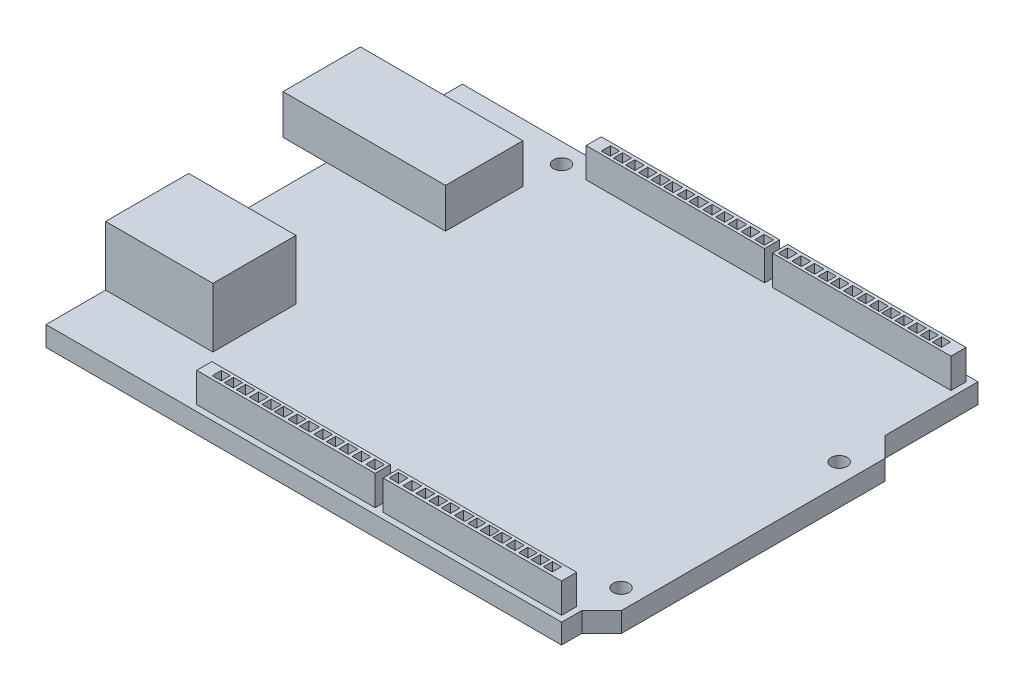
from build123d import *

# Parameters (mm, degrees)
SKETCH1_R           = 1.016
BOSS_EXTRUDE1_DEPTH = 2.54
SKETCH2_W           = 22.86
SKETCH2_H           = 1.936469456
SKETCH2_W_2         = 1.224555301
SKETCH2_H_2         = 1.184738843
SKETCH2_W_3         = 1.222138065
SKETCH2_W_4         = 1.222742374
SKETCH2_W_5         = 1.155879365
SKETCH2_W_6         = 1.199648959
SKETCH2_W_7         = 1.333979287
SKETCH2_W_8         = 1.107879608
SKETCH2_W_9         = 1.267720586
SKETCH2_W_10        = 1.269533513
SKETCH2_W_11        = 1.179577089
SKETCH2_W_12        = 1.200253268
SKETCH2_W_13        = 1.159505218
SKETCH2_W_14        = 1.15346213
SKETCH2_W_15        = 1.179577088
SKETCH2_W_16        = 1.269533512
SKETCH2_W_17        = 1.107879609
SKETCH2_W_18        = 1.153462129
BOSS_EXTRUDE2_DEPTH = 3.81
SKETCH3_W           = 15.229234195
SKETCH3_H           = 9.911935399
SKETCH3_W_2         = 5.581245223
BOSS_EXTRUDE3_DEPTH = 5.08
SKETCH4_W           = 13.73941142
SKETCH4_H           = 10.645162834
BOSS_EXTRUDE4_DEPTH = 7.62
SKETCH5_R           = 3.391596973
CUT_EXTRUDE1_DEPTH  = 7.62
SKETCH6_W           = 9.111468131
SKETCH6_H           = 4.354820338
CUT_EXTRUDE2_DEPTH  = 15.24
SKETCH7_W           = 8.100895968
SKETCH7_H           = 1.84111272
BOSS_EXTRUDE5_DEPTH = 13.97


with BuildPart() as part:
    # Sketch1 → Boss-Extrude1 (new body)
    with BuildSketch(Plane(origin=(0, 0, 0), x_dir=(1, 0, 0), z_dir=(0, 1, 0))):
        Polygon((0, 0), (66.04, 0), (66.04, 2.625008891), (68.58, 5.165008891), (68.58, 38.871058374), (66.04, 41.411058374), (66.04, 53.34), (0, 53.34), align=None)
        with Locations(Location((66.04, 7.62, 0), (0, 0, 270))):
            Circle(SKETCH1_R, mode=Mode.SUBTRACT)
        with Locations(Location((66.04, 35.56, 0), (0, 0, 270))):
            Circle(SKETCH1_R, mode=Mode.SUBTRACT)
        with Locations(Location((15.24, 50.8, 0), (0, 0, 270))):
            Circle(SKETCH1_R, mode=Mode.SUBTRACT)
    extrude(amount=BOSS_EXTRUDE1_DEPTH)

    # Sketch2 → Boss-Extrude2 (add)
    # profile 1 of 4: a face of its own
    with BuildSketch(Plane(origin=(0, 2.54, 0), x_dir=(1, 0, 0), z_dir=(0, 1, 0))):
        with Locations((53.845851386, 51.609765272)):
            Rectangle(SKETCH2_W, SKETCH2_H)
        with Locations((43.404283902, 51.588990463)):
            Rectangle(SKETCH2_W_2, SKETCH2_H_2, mode=Mode.SUBTRACT)
        with Locations((45.159038485, 51.588990463)):
            Rectangle(SKETCH2_W_3, SKETCH2_H_2, mode=Mode.SUBTRACT)
        with Locations((46.847232211, 51.588990463)):
            Rectangle(SKETCH2_W_4, SKETCH2_H_2, mode=Mode.SUBTRACT)
        with Locations((48.479807482, 51.588990463)):
            Rectangle(SKETCH2_W_5, SKETCH2_H_2, mode=Mode.SUBTRACT)
        with Locations((50.07774263, 51.588990463)):
            Rectangle(SKETCH2_W_6, SKETCH2_H_2, mode=Mode.SUBTRACT)
        with Locations((51.809101642, 51.588990463)):
            Rectangle(SKETCH2_W_7, SKETCH2_H_2, mode=Mode.SUBTRACT)
        with Locations((53.430130204, 51.588990463)):
            Rectangle(SKETCH2_W_8, SKETCH2_H_2, mode=Mode.SUBTRACT)
        with Locations((55.084892426, 51.588990463)):
            Rectangle(SKETCH2_W_9, SKETCH2_H_2, mode=Mode.SUBTRACT)
        with Locations((56.683734038, 51.588990463)):
            Rectangle(SKETCH2_W_10, SKETCH2_H_2, mode=Mode.SUBTRACT)
        with Locations((58.327251707, 51.588990463)):
            Rectangle(SKETCH2_W_11, SKETCH2_H_2, mode=Mode.SUBTRACT)
        with Locations((59.980503156, 51.588990463)):
            Rectangle(SKETCH2_W_12, SKETCH2_H_2, mode=Mode.SUBTRACT)
        with Locations((61.556251353, 51.588990463)):
            Rectangle(SKETCH2_W_13, SKETCH2_H_2, mode=Mode.SUBTRACT)
        with Locations((63.107999671, 51.588990463)):
            Rectangle(SKETCH2_W_14, SKETCH2_H_2, mode=Mode.SUBTRACT)
    # profile 2 of 4: a face of its own
    with BuildSketch(Plane(origin=(0, 2.54, 0), x_dir=(1, 0, 0), z_dir=(0, 1, 0))):
        with Locations((29.969851386, 51.609765272)):
            Rectangle(SKETCH2_W, SKETCH2_H)
        with Locations((40.411418869, 51.588990463)):
            Rectangle(SKETCH2_W_2, SKETCH2_H_2, mode=Mode.SUBTRACT)
        with Locations((22.25945142, 51.588990463)):
            Rectangle(SKETCH2_W_13, SKETCH2_H_2, mode=Mode.SUBTRACT)
        with Locations((23.835199616, 51.588990463)):
            Rectangle(SKETCH2_W_12, SKETCH2_H_2, mode=Mode.SUBTRACT)
        with Locations((25.488451066, 51.588990463)):
            Rectangle(SKETCH2_W_15, SKETCH2_H_2, mode=Mode.SUBTRACT)
        with Locations((27.131968735, 51.588990463)):
            Rectangle(SKETCH2_W_16, SKETCH2_H_2, mode=Mode.SUBTRACT)
        with Locations((28.730810346, 51.588990463)):
            Rectangle(SKETCH2_W_9, SKETCH2_H_2, mode=Mode.SUBTRACT)
        with Locations((30.385572569, 51.588990463)):
            Rectangle(SKETCH2_W_17, SKETCH2_H_2, mode=Mode.SUBTRACT)
        with Locations((32.006601132, 51.588990463)):
            Rectangle(SKETCH2_W_7, SKETCH2_H_2, mode=Mode.SUBTRACT)
        with Locations((33.737960144, 51.588990463)):
            Rectangle(SKETCH2_W_6, SKETCH2_H_2, mode=Mode.SUBTRACT)
        with Locations((35.335895292, 51.588990463)):
            Rectangle(SKETCH2_W_5, SKETCH2_H_2, mode=Mode.SUBTRACT)
        with Locations((36.968470562, 51.588990463)):
            Rectangle(SKETCH2_W_4, SKETCH2_H_2, mode=Mode.SUBTRACT)
        with Locations((38.656664289, 51.588990463)):
            Rectangle(SKETCH2_W_3, SKETCH2_H_2, mode=Mode.SUBTRACT)
        with Locations((20.707703102, 51.588990463)):
            Rectangle(SKETCH2_W_18, SKETCH2_H_2, mode=Mode.SUBTRACT)
    # profile 3 of 4: a face of its own
    with BuildSketch(Plane(origin=(0, 2.54, 0), x_dir=(1, 0, 0), z_dir=(0, 1, 0))):
        with Locations((53.845851386, 1.730234728)):
            Rectangle(SKETCH2_W, SKETCH2_H)
        with Locations((63.107999671, 1.751009538)):
            Rectangle(SKETCH2_W_14, SKETCH2_H_2, mode=Mode.SUBTRACT)
        with Locations((61.556251353, 1.751009538)):
            Rectangle(SKETCH2_W_13, SKETCH2_H_2, mode=Mode.SUBTRACT)
        with Locations((59.980503156, 1.751009538)):
            Rectangle(SKETCH2_W_12, SKETCH2_H_2, mode=Mode.SUBTRACT)
        with Locations((58.327251707, 1.751009538)):
            Rectangle(SKETCH2_W_11, SKETCH2_H_2, mode=Mode.SUBTRACT)
        with Locations((56.683734038, 1.751009538)):
            Rectangle(SKETCH2_W_10, SKETCH2_H_2, mode=Mode.SUBTRACT)
        with Locations((55.084892426, 1.751009538)):
            Rectangle(SKETCH2_W_9, SKETCH2_H_2, mode=Mode.SUBTRACT)
        with Locations((53.430130204, 1.751009538)):
            Rectangle(SKETCH2_W_8, SKETCH2_H_2, mode=Mode.SUBTRACT)
        with Locations((51.809101642, 1.751009538)):
            Rectangle(SKETCH2_W_7, SKETCH2_H_2, mode=Mode.SUBTRACT)
        with Locations((50.07774263, 1.751009538)):
            Rectangle(SKETCH2_W_6, SKETCH2_H_2, mode=Mode.SUBTRACT)
        with Locations((48.479807482, 1.751009538)):
            Rectangle(SKETCH2_W_5, SKETCH2_H_2, mode=Mode.SUBTRACT)
        with Locations((46.847232211, 1.751009538)):
            Rectangle(SKETCH2_W_4, SKETCH2_H_2, mode=Mode.SUBTRACT)
        with Locations((45.159038485, 1.751009538)):
            Rectangle(SKETCH2_W_3, SKETCH2_H_2, mode=Mode.SUBTRACT)
        with Locations((43.404283902, 1.751009538)):
            Rectangle(SKETCH2_W_2, SKETCH2_H_2, mode=Mode.SUBTRACT)
    # profile 4 of 4: a face of its own
    with BuildSketch(Plane(origin=(0, 2.54, 0), x_dir=(1, 0, 0), z_dir=(0, 1, 0))):
        with Locations((29.969851386, 1.730234728)):
            Rectangle(SKETCH2_W, SKETCH2_H)
        with Locations((20.707703102, 1.751009538)):
            Rectangle(SKETCH2_W_18, SKETCH2_H_2, mode=Mode.SUBTRACT)
        with Locations((40.411418869, 1.751009538)):
            Rectangle(SKETCH2_W_2, SKETCH2_H_2, mode=Mode.SUBTRACT)
        with Locations((38.656664289, 1.751009538)):
            Rectangle(SKETCH2_W_3, SKETCH2_H_2, mode=Mode.SUBTRACT)
        with Locations((36.968470562, 1.751009538)):
            Rectangle(SKETCH2_W_4, SKETCH2_H_2, mode=Mode.SUBTRACT)
        with Locations((35.335895292, 1.751009538)):
            Rectangle(SKETCH2_W_5, SKETCH2_H_2, mode=Mode.SUBTRACT)
        with Locations((33.737960144, 1.751009538)):
            Rectangle(SKETCH2_W_6, SKETCH2_H_2, mode=Mode.SUBTRACT)
        with Locations((32.006601132, 1.751009538)):
            Rectangle(SKETCH2_W_7, SKETCH2_H_2, mode=Mode.SUBTRACT)
        with Locations((30.385572569, 1.751009538)):
            Rectangle(SKETCH2_W_17, SKETCH2_H_2, mode=Mode.SUBTRACT)
        with Locations((28.730810346, 1.751009538)):
            Rectangle(SKETCH2_W_9, SKETCH2_H_2, mode=Mode.SUBTRACT)
        with Locations((27.131968735, 1.751009538)):
            Rectangle(SKETCH2_W_16, SKETCH2_H_2, mode=Mode.SUBTRACT)
        with Locations((25.488451066, 1.751009538)):
            Rectangle(SKETCH2_W_15, SKETCH2_H_2, mode=Mode.SUBTRACT)
        with Locations((23.835199616, 1.751009538)):
            Rectangle(SKETCH2_W_12, SKETCH2_H_2, mode=Mode.SUBTRACT)
        with Locations((22.25945142, 1.751009538)):
            Rectangle(SKETCH2_W_13, SKETCH2_H_2, mode=Mode.SUBTRACT)
    extrude(amount=BOSS_EXTRUDE2_DEPTH)

    # Sketch3 → Boss-Extrude3 (add)
    with BuildSketch(Plane(origin=(0, 2.54, 0), x_dir=(1, 0, 0), z_dir=(0, 1, 0))):
        with Locations((7.614617098, 40.900300401)):
            Rectangle(SKETCH3_W, SKETCH3_H)
        with Locations((-2.790622612, 40.900300401)):
            Rectangle(SKETCH3_W_2, SKETCH3_H)
    extrude(amount=BOSS_EXTRUDE3_DEPTH)

    # Sketch4 → Boss-Extrude4 (add)
    with BuildSketch(Plane(origin=(0, 2.54, 0), x_dir=(1, 0, 0), z_dir=(0, 1, 0))):
        with Locations((6.86970571, 12.95827671)):
            Rectangle(SKETCH4_W, SKETCH4_H)
    extrude(amount=BOSS_EXTRUDE4_DEPTH)

    # Sketch5 → Cut-Extrude1 (cut)
    with BuildSketch(Plane.ZY):
        with Locations((-12.95827671, 6.35)):
            Circle(SKETCH5_R)
    extrude(amount=-CUT_EXTRUDE1_DEPTH, mode=Mode.SUBTRACT)

    # Sketch6 → Cut-Extrude2 (cut)
    with BuildSketch(Plane.ZY.offset(5.581245223)):
        with Locations((-40.943225462, 5.06780019)):
            Rectangle(SKETCH6_W, SKETCH6_H)
    extrude(amount=-CUT_EXTRUDE2_DEPTH, mode=Mode.SUBTRACT)

    # Sketch7 → Boss-Extrude5 (add)
    with BuildSketch(Plane.ZY.offset(-9.658754777)):
        with Locations((-40.957034707, 4.380377166)):
            Rectangle(SKETCH7_W, SKETCH7_H)
    extrude(amount=BOSS_EXTRUDE5_DEPTH)


solid = part.part
